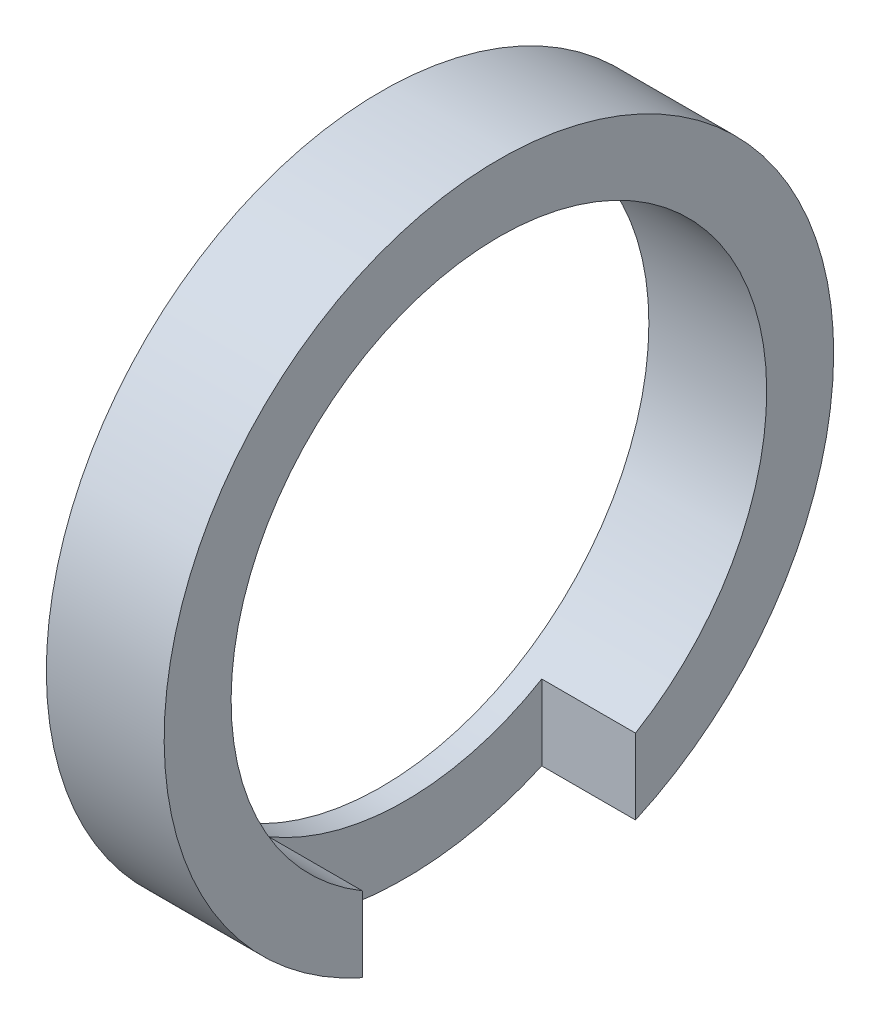
from build123d import *

# Parameters (mm, degrees)
SKETCH1_R           = 15.875
SKETCH1_R_2         = 12.7
BOSS_EXTRUDE1_DEPTH = 5.588
CUT_EXTRUDE2_START  = -4.445
CUT_EXTRUDE2_DEPTH  = 4.445


with BuildPart() as part:
    # Sketch1 → Boss-Extrude1 (new body)
    with BuildSketch(Plane(origin=(0, 0, 0), x_dir=(0, 0, -1), z_dir=(1, 0, 0))):
        Circle(SKETCH1_R)
        Circle(SKETCH1_R_2, mode=Mode.SUBTRACT)
    extrude(amount=BOSS_EXTRUDE1_DEPTH)

    # Sketch3 → Cut-Extrude2 (cut)
    with BuildSketch(Plane(origin=(5.588, 0, 0), x_dir=(0, 0, -1), z_dir=(1, 0, 0)).offset(CUT_EXTRUDE2_START)):
        with BuildLine():
            Line((-6.477, -10.924214892), (-6.477, -14.4935881))
            ThreePointArc((-6.477, -14.4935881), (0, -15.875), (6.477, -14.4935881))
            Line((6.477, -14.4935881), (6.477, -10.924214892))
            Line((6.477, -10.924214892), (-6.477, -10.924214892))
        make_face()
    extrude(amount=CUT_EXTRUDE2_DEPTH, mode=Mode.SUBTRACT)


solid = part.part
